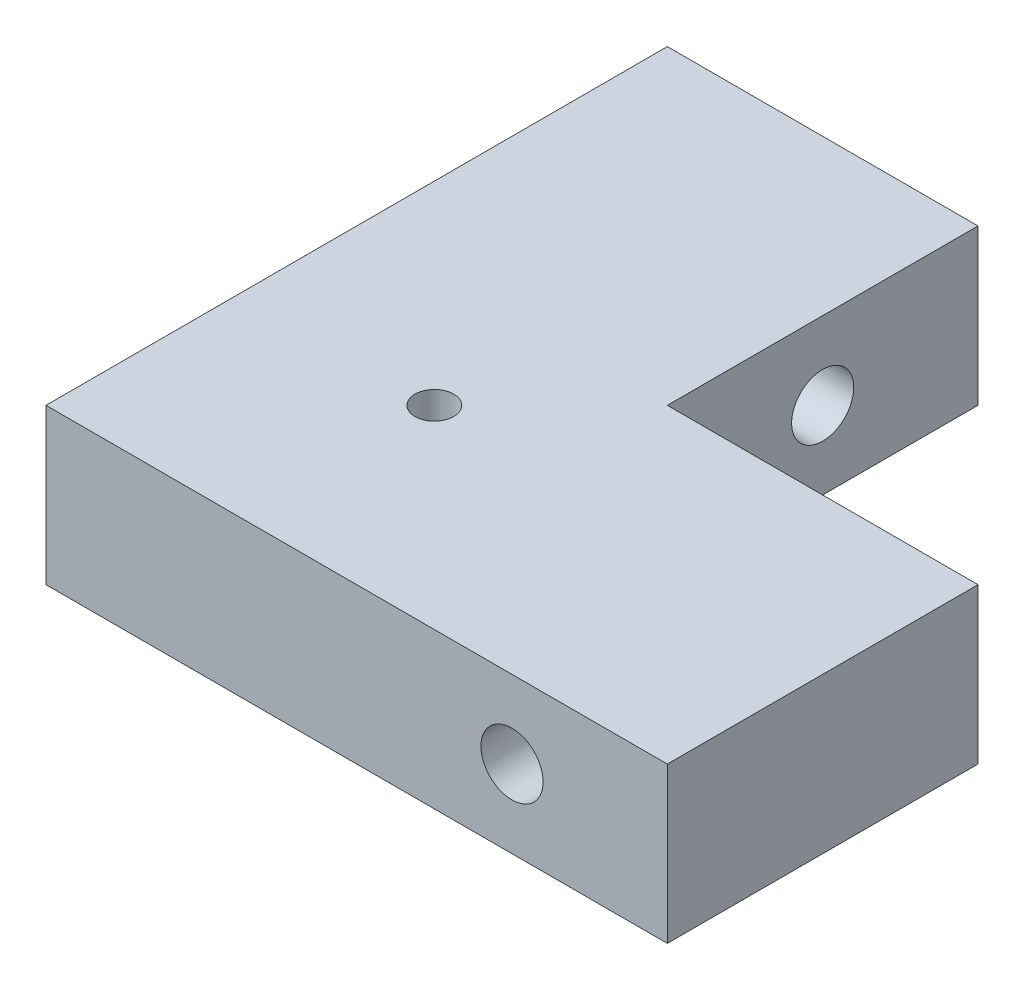
from build123d import *

# Parameters (mm, degrees)
RESSALTO_EXTRUS_O1_DEPTH = 20
ESBO_O3_R                = 4
CORTE_EXTRUS_O1_DEPTH    = 63.524475359
ESBO_O4_R                = 4
CORTE_EXTRUS_O2_DEPTH    = 84.066238629
ESBO_O5_R                = 2.5
CORTE_EXTRUS_O3_DEPTH    = 85.907655832


with BuildPart() as part:
    # Esboço1 → Ressalto-extrusão1 (new body)
    with BuildSketch(Plane(origin=(0, 0, 0), x_dir=(1, 0, 0), z_dir=(0, 1, 0))):
        Polygon((-70, 36.304347826), (-70, -43.695652174), (10, -43.695652174), (10, -3.695652174), (-30, -3.695652174), (-30, 36.304347826), align=None)
    extrude(amount=RESSALTO_EXTRUS_O1_DEPTH)

    # Esboço3 → Corte-extrusão1 (cut, through all)
    with BuildSketch(Plane(origin=(-30, 0, 0), x_dir=(0, 0, -1), z_dir=(1, 0, 0))):
        with Locations((16.304347826, 10)):
            Circle(ESBO_O3_R)
    extrude(amount=-CORTE_EXTRUS_O1_DEPTH, mode=Mode.SUBTRACT)

    # Esboço4 → Corte-extrusão2 (cut, through all)
    with BuildSketch(Plane(origin=(0, 0, 3.695652174), x_dir=(-1, 0, 0), z_dir=(0, 0, -1))):
        with Locations((10, 10)):
            Circle(ESBO_O4_R)
    extrude(amount=-CORTE_EXTRUS_O2_DEPTH, mode=Mode.SUBTRACT)

    # Esboço5 → Corte-extrusão3 (cut, through all)
    with BuildSketch(Plane.XZ):
        with Locations(Location((-45, 18.695652174, 0), (0, 0, 270))):
            Circle(ESBO_O5_R)
    extrude(amount=-CORTE_EXTRUS_O3_DEPTH, mode=Mode.SUBTRACT)


solid = part.part
